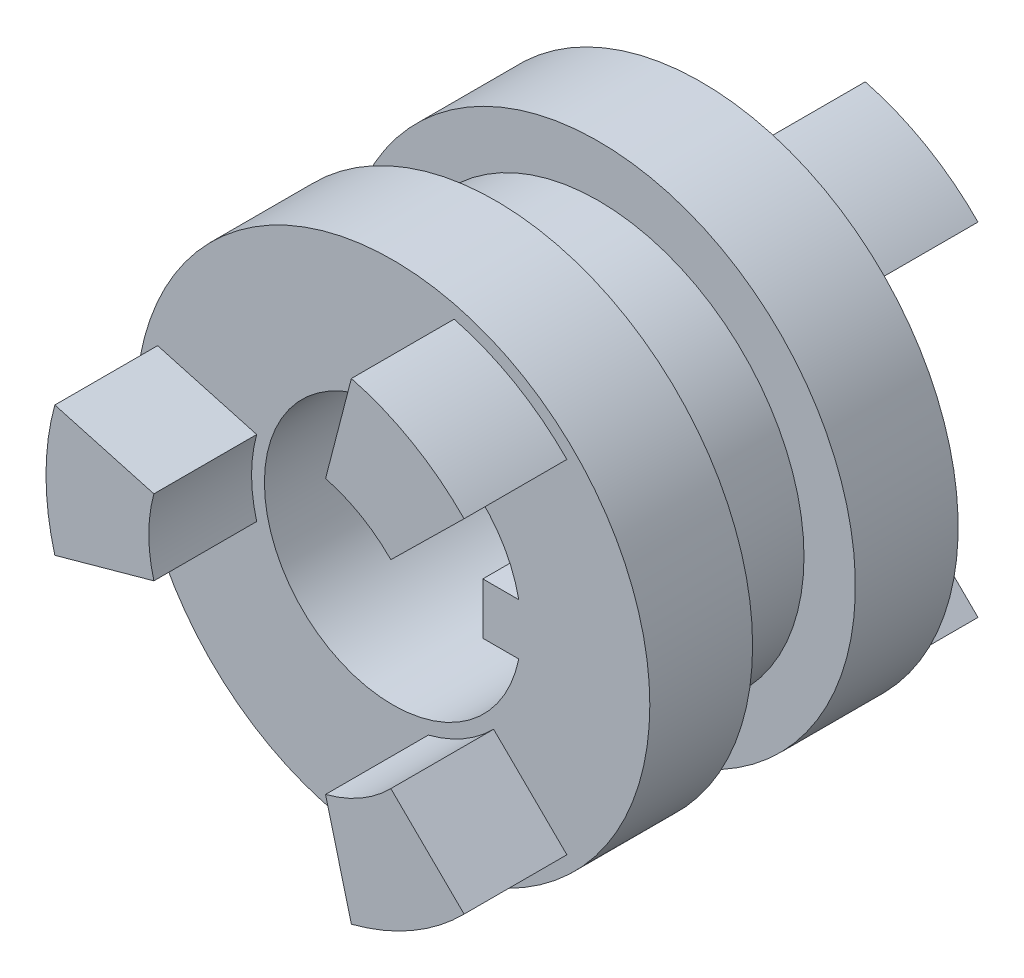
from build123d import *

# Parameters (mm, degrees)
SKETCH1_R           = 10
SKETCH1_R_2         = 5
BOSS_EXTRUDE2_DEPTH = 4
BOSS_EXTRUDE3_DEPTH = 4
SKETCH3_W           = 3
SKETCH3_H           = 2
BOSS_EXTRUDE4_DEPTH = 4
BOSS_EXTRUDE5_START = 4
SKETCH4_R           = 8
BOSS_EXTRUDE5_DEPTH = 4
BOSS_EXTRUDE6_START = 4
SKETCH5_R           = 10
BOSS_EXTRUDE6_DEPTH = 4
BOSS_EXTRUDE7_START = 4
BOSS_EXTRUDE7_DEPTH = 4
BOSS_EXTRUDE8_DEPTH = 10


with BuildPart() as part:
    # Sketch1 → Boss-Extrude2 (new body)
    with BuildSketch(Plane.XY):
        Circle(SKETCH1_R)
        Circle(SKETCH1_R_2, mode=Mode.SUBTRACT)
    extrude(amount=BOSS_EXTRUDE2_DEPTH)

    # Sketch2 → Boss-Extrude3 (add)
    with BuildSketch(Plane.XY.offset(4)):
        with BuildLine():
            ThreePointArc((-5.5, 0), (-5.449982192, 0.74006358), (-5.300838508, 1.466666667))
            Line((-5.300838508, 1.466666667), (-9.155993787, 2.533333333))
            ThreePointArc((-9.155993787, 2.533333333), (-9.413605605, 1.278291639), (-9.5, 0))
            ThreePointArc((-9.5, 0), (-9.413605605, -1.278291639), (-9.155993787, -2.533333333))
            Line((-9.155993787, -2.533333333), (-5.300838508, -1.466666667))
            ThreePointArc((-5.300838508, -1.466666667), (-5.449982192, -0.74006358), (-5.5, 0))
        make_face()
        with BuildLine():
            ThreePointArc((3.920589846, -3.857327476), (2.75, -4.763139721), (1.380248662, -5.323994143))
            Line((1.380248662, -5.323994143), (2.38406587, -9.195989883))
            ThreePointArc((2.38406587, -9.195989883), (4.75, -8.227241336), (6.771927916, -6.66265655))
            Line((6.771927916, -6.66265655), (3.920589846, -3.857327476))
        make_face()
        with BuildLine():
            Line((2.38406587, 9.195989883), (1.380248662, 5.323994143))
            ThreePointArc((1.380248662, 5.323994143), (2.75, 4.763139721), (3.920589846, 3.857327476))
            Line((3.920589846, 3.857327476), (6.771927916, 6.66265655))
            ThreePointArc((6.771927916, 6.66265655), (4.75, 8.227241336), (2.38406587, 9.195989883))
        make_face()
    extrude(amount=BOSS_EXTRUDE3_DEPTH)

    # Sketch3 → Boss-Extrude4 (add)
    with BuildSketch(Plane(origin=(0, 0, 0), x_dir=(-1, 0, 0), z_dir=(0, 0, -1))):
        with Locations((-5, 0)):
            Rectangle(SKETCH3_W, SKETCH3_H)
    extrude(amount=-BOSS_EXTRUDE4_DEPTH)

    # Sketch4 → Boss-Extrude5 (add)
    with BuildSketch(Plane(origin=(0, 0, 0), x_dir=(-1, 0, 0), z_dir=(0, 0, -1)).offset(BOSS_EXTRUDE5_START)):
        Circle(SKETCH4_R)
        with BuildLine():
            Line((-4.974937186, 0.5), (-3.5, 0.5))
            Line((-3.5, 0.5), (-3.5, -1))
            Line((-3.5, -1), (-4.898979486, -1))
            ThreePointArc((-4.898979486, -1), (4.993601667, 0.252868331), (-4.974937186, 0.5))
        make_face(mode=Mode.SUBTRACT)
    extrude(amount=-BOSS_EXTRUDE5_DEPTH)

    # Sketch5 → Boss-Extrude6 (add)
    with BuildSketch(Plane(origin=(0, 0, -4), x_dir=(-1, 0, 0), z_dir=(0, 0, -1)).offset(BOSS_EXTRUDE6_START)):
        with Locations(Location((0, 0, 0), (0, 0, 180))):
            Circle(SKETCH5_R)
        with BuildLine():
            Line((-4.974937186, 0.5), (-3.5, 0.5))
            Line((-3.5, 0.5), (-3.5, -1))
            Line((-3.5, -1), (-4.898979486, -1))
            ThreePointArc((-4.898979486, -1), (4.993601667, 0.252868331), (-4.974937186, 0.5))
        make_face(mode=Mode.SUBTRACT)
    extrude(amount=-BOSS_EXTRUDE6_DEPTH)

    # Sketch6 → Boss-Extrude7 (add)
    with BuildSketch(Plane(origin=(0, 0, -8), x_dir=(-1, 0, 0), z_dir=(0, 0, -1)).offset(BOSS_EXTRUDE7_START)):
        with BuildLine():
            ThreePointArc((-3.920589846, 3.857327476), (-2.75, 4.763139721), (-1.380248662, 5.323994143))
            Line((-1.380248662, 5.323994143), (-2.38406587, 9.195989883))
            ThreePointArc((-2.38406587, 9.195989883), (-4.75, 8.227241336), (-6.771927916, 6.66265655))
            Line((-6.771927916, 6.66265655), (-3.920589846, 3.857327476))
        make_face()
        with BuildLine():
            ThreePointArc((-1.380248662, -5.323994143), (-2.75, -4.763139721), (-3.920589846, -3.857327476))
            Line((-3.920589846, -3.857327476), (-6.771927916, -6.66265655))
            ThreePointArc((-6.771927916, -6.66265655), (-4.75, -8.227241336), (-2.38406587, -9.195989883))
            Line((-2.38406587, -9.195989883), (-1.380248662, -5.323994143))
        make_face()
        with BuildLine():
            Line((9.155993787, 2.533333333), (5.300838508, 1.466666667))
            ThreePointArc((5.300838508, 1.466666667), (5.449982192, 0.74006358), (5.5, 0))
            ThreePointArc((5.5, 0), (5.449982192, -0.74006358), (5.300838508, -1.466666667))
            Line((5.300838508, -1.466666667), (9.155993787, -2.533333333))
            ThreePointArc((9.155993787, -2.533333333), (9.413605605, -1.278291639), (9.5, 0))
            ThreePointArc((9.5, 0), (9.413605605, 1.278291639), (9.155993787, 2.533333333))
        make_face()
    extrude(amount=-BOSS_EXTRUDE7_DEPTH)

    # Sketch10 → Boss-Extrude8 (add)
    with BuildSketch(Plane(origin=(0, 0, -8), x_dir=(-1, 0, 0), z_dir=(0, 0, -1))):
        with BuildLine():
            Line((-3.5, 1), (-4.898979486, 1))
            ThreePointArc((-4.898979486, 1), (-4.943284091, 0.75096098), (-4.974937186, 0.5))
            Line((-4.974937186, 0.5), (-3.5, 0.5))
            Line((-3.5, 0.5), (-3.5, 1))
        make_face()
    extrude(amount=-BOSS_EXTRUDE8_DEPTH)


solid = part.part
